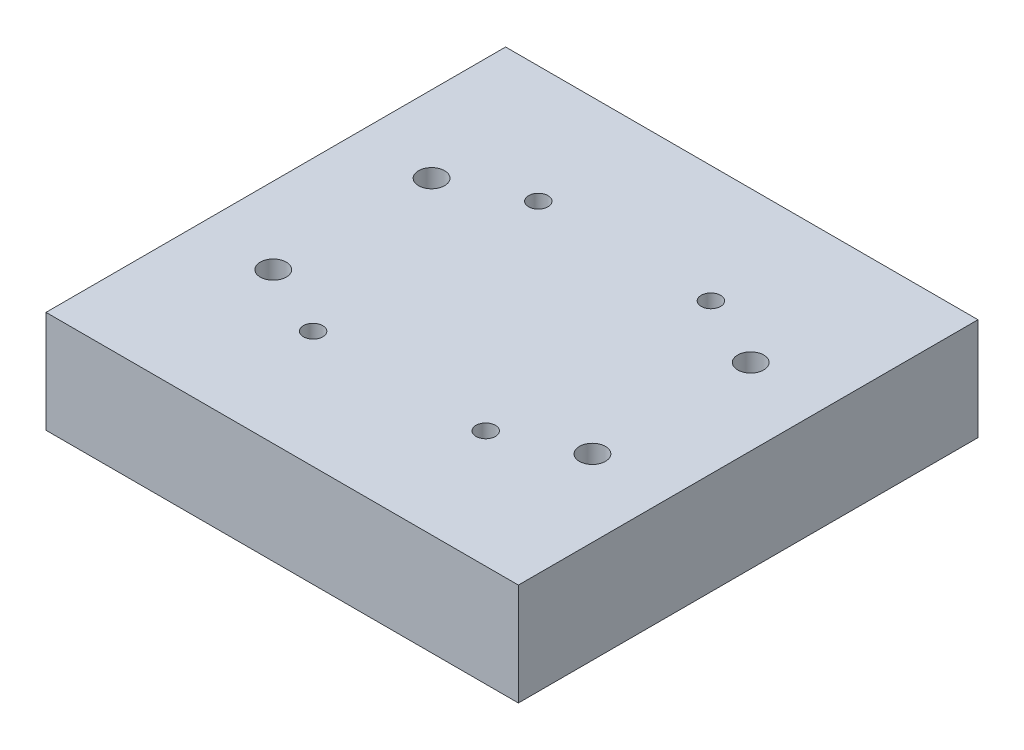
from build123d import *

# Parameters (mm, degrees)
SKETCH1_W           = 234.95
SKETCH1_H           = 228.6
BOSS_EXTRUDE1_DEPTH = 50.8
SKETCH2_R           = 4.826
CUT_EXTRUDE1_DEPTH  = 38.1
SKETCH3_R           = 6.477
CUT_EXTRUDE2_DEPTH  = 38.1


with BuildPart() as part:
    # Sketch1 → Boss-Extrude1 (new body)
    with BuildSketch(Plane(origin=(0, 0, 0), x_dir=(1, 0, 0), z_dir=(0, 1, 0))):
        with Locations((117.475, 114.3)):
            Rectangle(SKETCH1_W, SKETCH1_H)
    extrude(amount=BOSS_EXTRUDE1_DEPTH)

    # Sketch2 → Cut-Extrude1 (cut)
    with BuildSketch(Plane(origin=(0, 50.8, 0), x_dir=(1, 0, 0), z_dir=(0, 1, 0))):
        with Locations(Location((74.549, 170.307, 0), (0, 0, 270))):
            Circle(SKETCH2_R)
        with Locations(Location((160.401, 170.307, 0), (0, 0, 270))):
            Circle(SKETCH2_R)
        with Locations(Location((160.401, 58.293, 0), (0, 0, 270))):
            Circle(SKETCH2_R)
        with Locations(Location((74.549, 58.293, 0), (0, 0, 270))):
            Circle(SKETCH2_R)
    extrude(amount=-CUT_EXTRUDE1_DEPTH, mode=Mode.SUBTRACT)

    # Sketch3 → Cut-Extrude2 (cut)
    with BuildSketch(Plane(origin=(0, 50.8, 0), x_dir=(1, 0, 0), z_dir=(0, 1, 0))):
        with Locations(Location((196.85, 153.67, 0), (0, 0, 270))):
            Circle(SKETCH3_R)
        with Locations(Location((196.85, 74.93, 0), (0, 0, 270))):
            Circle(SKETCH3_R)
        with Locations(Location((38.1, 74.93, 0), (0, 0, 270))):
            Circle(SKETCH3_R)
        with Locations(Location((38.1, 153.67, 0), (0, 0, 270))):
            Circle(SKETCH3_R)
    extrude(amount=-CUT_EXTRUDE2_DEPTH, mode=Mode.SUBTRACT)


solid = part.part
